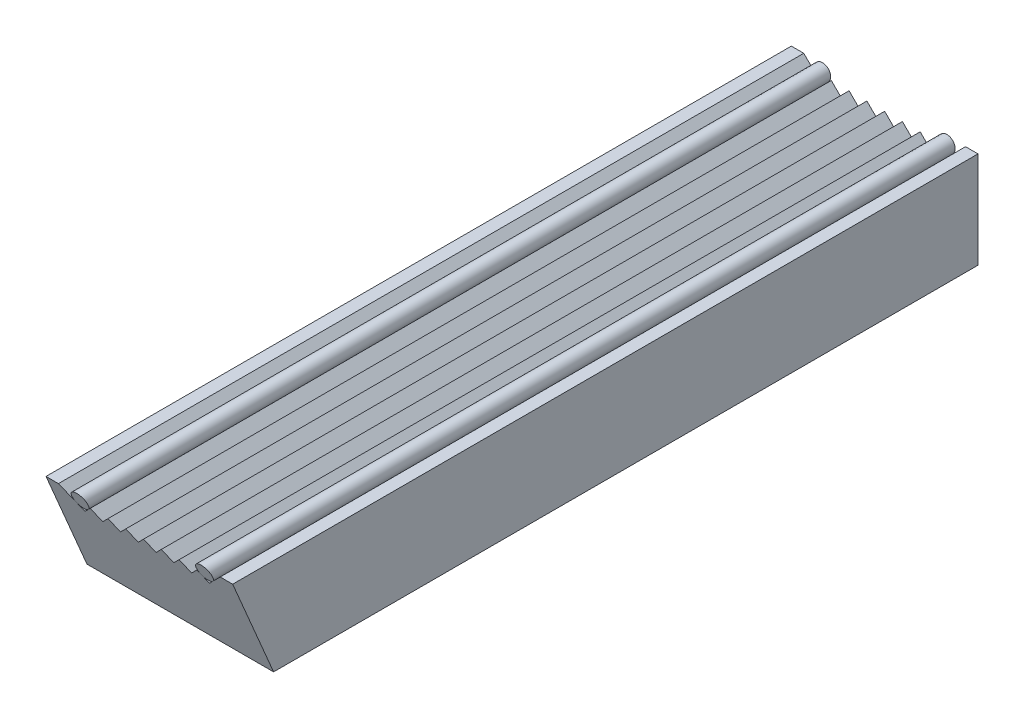
from build123d import *

# Parameters (mm, degrees)
SKETCH1_W           = 3
SKETCH1_H           = 1.55
BOSS_EXTRUDE1_DEPTH = 12
CUT_EXTRUDE1_DEPTH  = 13.466053907
SKETCH4_W           = 3
SKETCH4_H           = 0.03
BOSS_EXTRUDE2_DEPTH = 12
CUT_EXTRUDE2_DEPTH  = 13.466053907
BOSS_EXTRUDE3_REACH = 14.466
SKETCH6_R           = 0.13254834
SKETCH7_W           = 3
SKETCH7_H           = 0.03
CUT_EXTRUDE3_DEPTH  = 13.466053907


with BuildPart() as part:
    # Sketch1 → Boss-Extrude1 (new body)
    with BuildSketch(Plane.XY):
        with Locations((1.5, -0.775)):
            Rectangle(SKETCH1_W, SKETCH1_H)
    extrude(amount=BOSS_EXTRUDE1_DEPTH)

    # Sketch2 → Cut-Extrude1 (cut, through all)
    with BuildSketch(Plane.XY.offset(12)):
        Polygon((0.2, 0), (0.5, -0.3), (0.642857143, -0.157142857), (0.785714286, -0.3), (0.928571429, -0.157142857), (1.071428571, -0.3), (1.214285714, -0.157142857), (1.357142857, -0.3), (1.5, -0.157142857), (1.642857143, -0.3), (1.785714286, -0.157142857), (1.928571429, -0.3), (2.071428571, -0.157142857), (2.214285714, -0.3), (2.357142857, -0.157142857), (2.5, -0.3), (2.8, 0), align=None)
    extrude(amount=-CUT_EXTRUDE1_DEPTH, mode=Mode.SUBTRACT)


with BuildPart() as body_2:
    # Sketch4 → Boss-Extrude2 (new body)
    with BuildSketch(Plane.XY.offset(12)):
        with Locations((1.5, 0.035)):
            Rectangle(SKETCH4_W, SKETCH4_H)
    extrude(amount=-BOSS_EXTRUDE2_DEPTH)


with BuildPart() as cut_extrude2_tool:
    # Sketch5 → Cut-Extrude2 (new, through all)
    with BuildSketch(Plane(origin=(3, 0, 0), x_dir=(0, 0, -1), z_dir=(1, 0, 0))):
        Polygon((-12, 0.05), (-11.320840294, -1.55), (-12, -1.55), align=None)
    extrude(amount=-CUT_EXTRUDE2_DEPTH)


with BuildPart() as part_1:
    add(part.part)

    # Cut-Extrude2: cut by cut_extrude2_tool
    add(cut_extrude2_tool.part, mode=Mode.SUBTRACT)


with BuildPart() as body_2_1:
    add(body_2.part)

    # Cut-Extrude2: cut by cut_extrude2_tool
    add(cut_extrude2_tool.part, mode=Mode.SUBTRACT)

    # Sketch7 → Cut-Extrude3 (cut, through all)
    with BuildSketch(Plane(origin=(0, 0, 0), x_dir=(-1, 0, 0), z_dir=(0, 0, -1))):
        with Locations((-1.5, 0.035)):
            Rectangle(SKETCH7_W, SKETCH7_H)
    extrude(amount=-CUT_EXTRUDE3_DEPTH, mode=Mode.SUBTRACT)


with BuildPart() as body_3:
    # Boss-Extrude3: up to this plane
    boss_extrude3_end = Plane(origin=(0, 0.05, 12), z_dir=(0, 0.39073112848926705, -0.9205048534524433))
    # Sketch6 → Boss-Extrude3 (new, up to the surface)
    with BuildSketch(Plane(origin=(0, 0, 0), x_dir=(-1, 0, 0), z_dir=(0, 0, -1)), mode=Mode.PRIVATE) as boss_extrude3_sk1:
        with Locations((-2.5, -0.11254834)):
            Circle(SKETCH6_R)
    boss_extrude3_tool1 = split(extrude(boss_extrude3_sk1.sketch, amount=-BOSS_EXTRUDE3_REACH, mode=Mode.PRIVATE), bisect_by=boss_extrude3_end, keep=Keep.BOTH, mode=Mode.PRIVATE)
    add(boss_extrude3_tool1.solids().sort_by_distance((2.5, -0.112548, 0))[0])
    # Sketch6 → Boss-Extrude3 (new, up to the surface)
    with BuildSketch(Plane(origin=(0, 0, 0), x_dir=(-1, 0, 0), z_dir=(0, 0, -1)), mode=Mode.PRIVATE) as boss_extrude3_sk2:
        with Locations((-0.5, -0.11254834)):
            Circle(SKETCH6_R)
    boss_extrude3_tool2 = split(extrude(boss_extrude3_sk2.sketch, amount=-BOSS_EXTRUDE3_REACH, mode=Mode.PRIVATE), bisect_by=boss_extrude3_end, keep=Keep.BOTH, mode=Mode.PRIVATE)
    add(boss_extrude3_tool2.solids().sort_by_distance((0.5, -0.112548, 0))[0])


solid = Compound([part_1.part, body_3.part])
